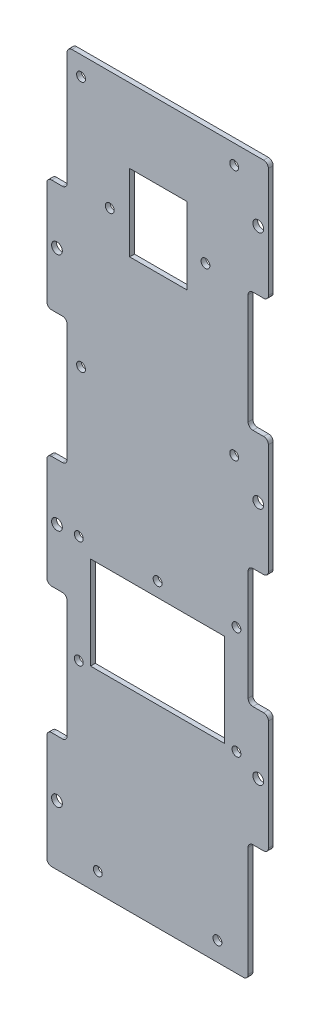
from build123d import *

# Parameters (mm, degrees)
SKETCH1_W           = 92.6
SKETCH1_H           = 300
BOSS_EXTRUDE1_DEPTH = 2
SKETCH2_R           = 2.25
SKETCH2_W           = 8.48
SKETCH2_H           = 51.5
SKETCH2_H_2         = 50
SKETCH2_H_3         = 53
CUT_EXTRUDE2_DEPTH  = 10
FILLET1_R           = 2
SKETCH3_R           = 1.85
CUT_EXTRUDE3_DEPTH  = 10
SKETCH4_R           = 1.85
SKETCH4_W           = 55.985713182
SKETCH4_H           = 38.778571429
CUT_EXTRUDE4_DEPTH  = 5
SKETCH5_R           = 1.85
SKETCH5_W           = 23.899789691
SKETCH5_H           = 32
CUT_EXTRUDE5_DEPTH  = 5


with BuildPart() as part:
    # Sketch1 → Boss-Extrude1 (new body)
    with BuildSketch(Plane.XY):
        Rectangle(SKETCH1_W, SKETCH1_H)
    extrude(amount=BOSS_EXTRUDE1_DEPTH)

    # Sketch2 → Cut-Extrude2 (cut)
    with BuildSketch(Plane.XY):
        with Locations((-42.06, 75)):
            Circle(SKETCH2_R)
        with Locations((42.06, 125)):
            Circle(SKETCH2_R)
        with Locations((42.06, 25)):
            Circle(SKETCH2_R)
        with Locations((42.06, -75)):
            Circle(SKETCH2_R)
        with Locations((-42.06, -25)):
            Circle(SKETCH2_R)
        with Locations((-42.06, -125)):
            Circle(SKETCH2_R)
        with Locations((-42.06, 124.25)):
            Rectangle(SKETCH2_W, SKETCH2_H)
        with Locations((42.06, 75)):
            Rectangle(SKETCH2_W, SKETCH2_H_2)
        with Locations((42.06, -25)):
            Rectangle(SKETCH2_W, SKETCH2_H_2)
        with Locations((-42.06, 25)):
            Rectangle(SKETCH2_W, SKETCH2_H_3)
        with Locations((-42.06, -75)):
            Rectangle(SKETCH2_W, SKETCH2_H_3)
        with Locations((42.06, -125)):
            Rectangle(SKETCH2_W, SKETCH2_H_2)
    extrude(amount=CUT_EXTRUDE2_DEPTH, mode=Mode.SUBTRACT)

    # Fillet1
    fillet1_edges = [part.edges().sort_by_distance(p)[0] for p in [
        (46.3, -100, 1),
        (37.82, -100, 1),
        (37.82, -150, 1),
        (46.3, 50, 1),
        (46.3, 100, 1),
        (37.82, 100, 1),
        (37.82, 50, 1),
        (-46.3, -48.5, 1),
        (-46.3, -101.5, 1),
        (-37.82, -101.5, 1),
        (-37.82, -48.5, 1),
        (37.82, 0, 1),
        (37.82, -50, 1),
        (46.3, -50, 1),
        (46.3, 0, 1),
        (46.3, 150, 1),
        (-46.3, 51.5, 1),
        (-46.3, -150, 1),
        (-46.3, -1.5, 1),
        (-37.82, -1.5, 1),
        (-37.82, 51.5, 1),
        (-46.3, 98.5, 1),
        (-37.82, 98.5, 1),
        (-37.82, 150, 1),
    ]]
    fillet(fillet1_edges, radius=FILLET1_R)

    # Sketch3 → Cut-Extrude3 (cut)
    with BuildSketch(Plane(origin=(0, 0, 0), x_dir=(-1, 0, 0), z_dir=(0, 0, -1))):
        with Locations((-25, -142)):
            Circle(SKETCH3_R)
        with Locations((25, -142)):
            Circle(SKETCH3_R)
        with Locations((-32, 142)):
            Circle(SKETCH3_R)
        with Locations((32, 142)):
            Circle(SKETCH3_R)
    extrude(amount=-CUT_EXTRUDE3_DEPTH, mode=Mode.SUBTRACT)

    # Sketch4 → Cut-Extrude4 (cut)
    with BuildSketch(Plane(origin=(0, 0, 0), x_dir=(-1, 0, 0), z_dir=(0, 0, -1))):
        with Locations((-32.95, -24.767949192)):
            Circle(SKETCH4_R)
        with Locations((0, -24.5)):
            Circle(SKETCH4_R)
        with Locations((32.95, -24.767949192)):
            Circle(SKETCH4_R)
        with Locations((-32.95, -69.732050808)):
            Circle(SKETCH4_R)
        with Locations((32.95, -69.732050808)):
            Circle(SKETCH4_R)
        with Locations((0.042856591, -49.889285715)):
            Rectangle(SKETCH4_W, SKETCH4_H)
    extrude(amount=-CUT_EXTRUDE4_DEPTH, mode=Mode.SUBTRACT)

    # Sketch5 → Cut-Extrude5 (cut)
    with BuildSketch(Plane(origin=(0, 0, 0), x_dir=(-1, 0, 0), z_dir=(0, 0, -1))):
        with Locations((-20, 100.5)):
            Circle(SKETCH5_R)
        with Locations((20, 100.5)):
            Circle(SKETCH5_R)
        with Locations((32, 37)):
            Circle(SKETCH5_R)
        with Locations((-32, 37)):
            Circle(SKETCH5_R)
        with Locations((-0.26347569, 103)):
            Rectangle(SKETCH5_W, SKETCH5_H)
    extrude(amount=-CUT_EXTRUDE5_DEPTH, mode=Mode.SUBTRACT)


solid = part.part
